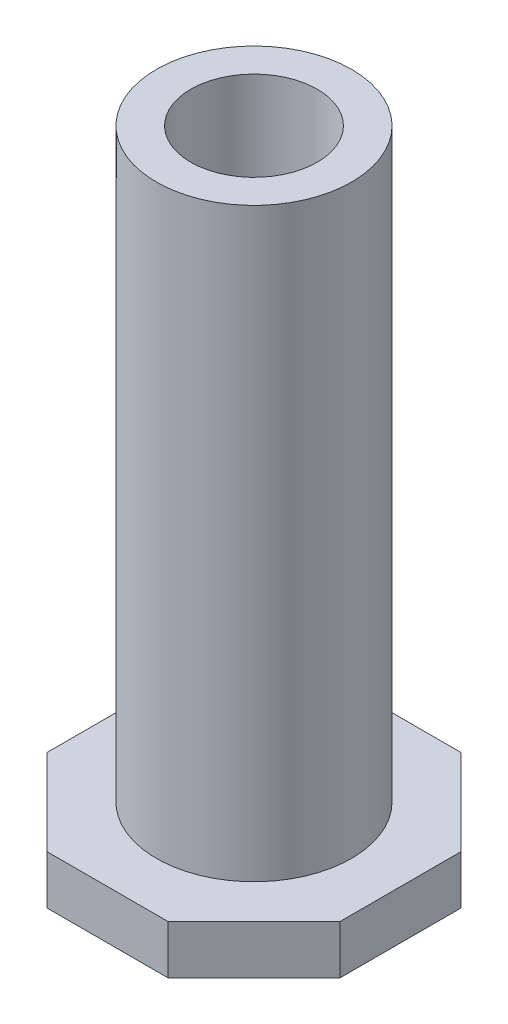
from build123d import *

# Parameters (mm, degrees)
BOSS_EXTRUDE1_DEPTH = 1.5875
SKETCH2_R           = 3.175
BOSS_EXTRUDE2_DEPTH = 19.05
SKETCH3_R           = 2.0574
CUT_EXTRUDE1_DEPTH  = 6.35


with BuildPart() as part:
    # Sketch1 → Boss-Extrude1 (new body)
    with BuildSketch(Plane(origin=(0, 0, 0), x_dir=(1, 0, 0), z_dir=(0, 1, 0))):
        Polygon((4.7625, -1.972692091), (4.7625, 1.972692091), (1.972692091, 4.7625), (-1.972692091, 4.7625), (-4.7625, 1.972692091), (-4.7625, -1.972692091), (-1.972692091, -4.7625), (1.972692091, -4.7625), align=None)
    extrude(amount=BOSS_EXTRUDE1_DEPTH)

    # Sketch2 → Boss-Extrude2 (add)
    with BuildSketch(Plane(origin=(0, 1.5875, 0), x_dir=(1, 0, 0), z_dir=(0, 1, 0))):
        with Locations(Location((0, 0, 0), (0, 0, 90))):
            Circle(SKETCH2_R)
    extrude(amount=BOSS_EXTRUDE2_DEPTH)

    # Sketch3 → Cut-Extrude1 (cut)
    with BuildSketch(Plane(origin=(0, 20.6375, 0), x_dir=(1, 0, 0), z_dir=(0, 1, 0))):
        with Locations(Location((0, 0, 0), (0, 0, 270))):
            Circle(SKETCH3_R)
    extrude(amount=-CUT_EXTRUDE1_DEPTH, mode=Mode.SUBTRACT)


solid = part.part
